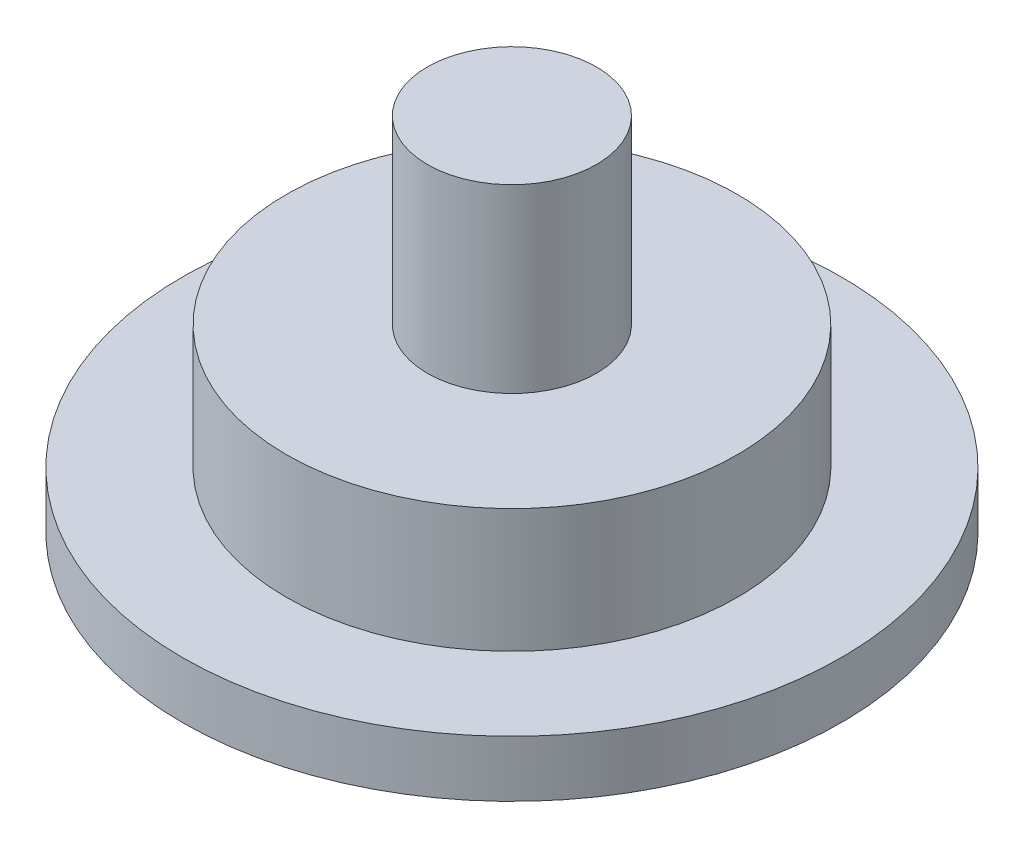
from build123d import *

# Parameters (mm, degrees)
SKETCH1_R           = 7.6
BOSS_EXTRUDE1_DEPTH = 1.3
SKETCH2_R           = 5.2
BOSS_EXTRUDE2_DEPTH = 2.85
SKETCH3_R           = 1.95
BOSS_EXTRUDE3_DEPTH = 4.17
SKETCH4_R           = 4.4
CUT_EXTRUDE1_DEPTH  = 2.76


with BuildPart() as part:
    # Sketch1 → Boss-Extrude1 (new body)
    with BuildSketch(Plane(origin=(0, 0, 0), x_dir=(1, 0, 0), z_dir=(0, 1, 0))):
        with Locations(Location((0, 0, 0), (0, 0, 270))):
            Circle(SKETCH1_R)
    extrude(amount=BOSS_EXTRUDE1_DEPTH)

    # Sketch2 → Boss-Extrude2 (add)
    with BuildSketch(Plane(origin=(0, 1.3, 0), x_dir=(1, 0, 0), z_dir=(0, 1, 0))):
        with Locations(Location((0, 0, 0), (0, 0, 270))):
            Circle(SKETCH2_R)
    extrude(amount=BOSS_EXTRUDE2_DEPTH)

    # Sketch3 → Boss-Extrude3 (add)
    with BuildSketch(Plane(origin=(0, 4.15, 0), x_dir=(1, 0, 0), z_dir=(0, 1, 0))):
        with Locations(Location((0, 0, 0), (0, 0, 270))):
            Circle(SKETCH3_R)
    extrude(amount=BOSS_EXTRUDE3_DEPTH)

    # Sketch4 → Cut-Extrude1 (cut)
    with BuildSketch(Plane(origin=(0, 0, 0), x_dir=(-1, 0, 0), z_dir=(0, -1, 0))):
        with Locations(Location((0, 0, 0), (0, 0, 90))):
            Circle(SKETCH4_R)
    extrude(amount=-CUT_EXTRUDE1_DEPTH, mode=Mode.SUBTRACT)


solid = part.part
